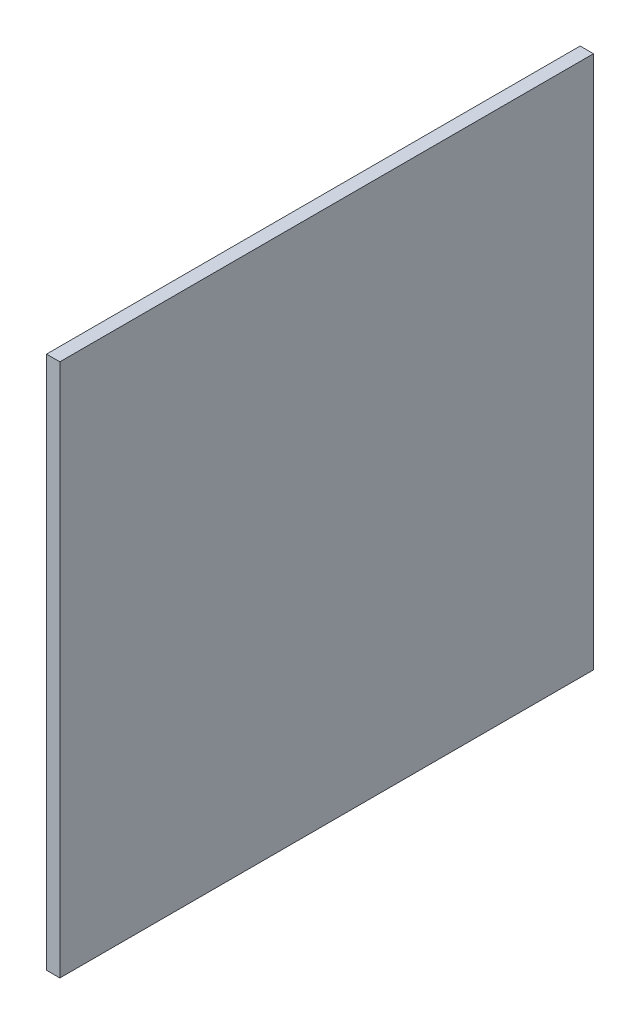
from build123d import *

# Parameters (mm, degrees)
SKETCH1_W           = 400
SKETCH1_H           = 400
BOSS_EXTRUDE1_DEPTH = 10


with BuildPart() as part:
    # Sketch1 → Boss-Extrude1 (new body)
    with BuildSketch(Plane(origin=(0, 0, 0), x_dir=(0, 0, -1), z_dir=(1, 0, 0))):
        Rectangle(SKETCH1_W, SKETCH1_H)
    extrude(amount=BOSS_EXTRUDE1_DEPTH)


solid = part.part
